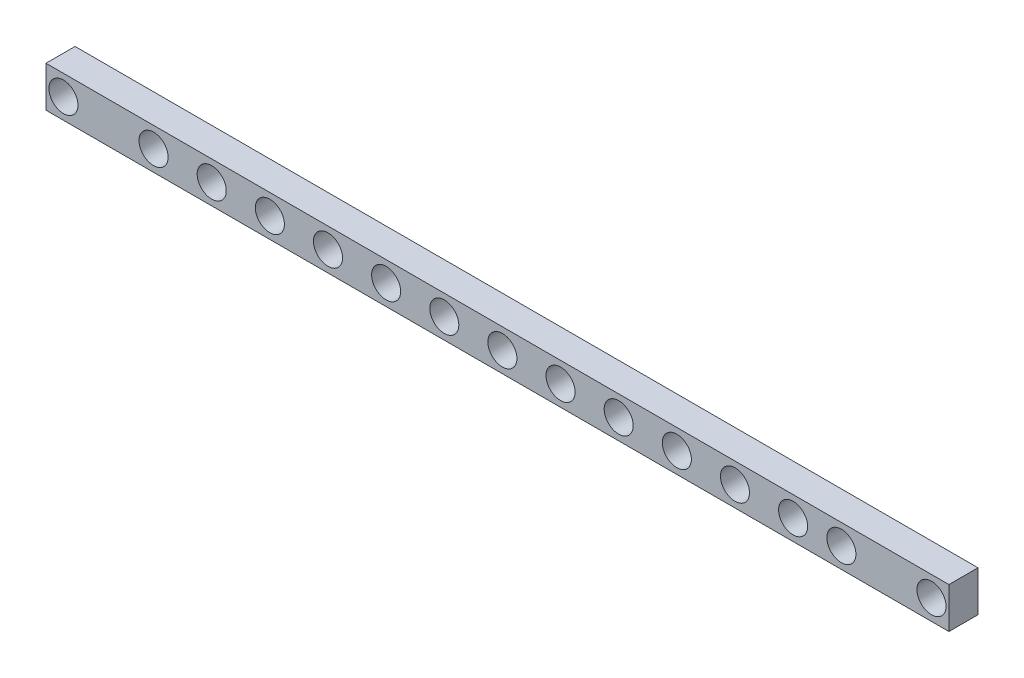
from build123d import *

# Parameters (mm, degrees)
SKETCH1_W           = 15.53
SKETCH1_H           = 0.7
SKETCH1_R           = 0.25
BOSS_EXTRUDE1_DEPTH = 0.5


with BuildPart() as part:
    # Sketch1 → Boss-Extrude1 (new body)
    with BuildSketch(Plane.XY):
        Rectangle(SKETCH1_W, SKETCH1_H)
        with Locations((-7.465, 0)):
            Circle(SKETCH1_R, mode=Mode.SUBTRACT)
        with Locations((-5.915, 0)):
            Circle(SKETCH1_R, mode=Mode.SUBTRACT)
        with Locations(Location((5.915, 0, 0), (0, 0, 180))):
            Circle(SKETCH1_R, mode=Mode.SUBTRACT)
        with Locations(Location((7.465, 0, 0), (0, 0, 180))):
            Circle(SKETCH1_R, mode=Mode.SUBTRACT)
        with Locations((-4.915, 0)):
            Circle(SKETCH1_R, mode=Mode.SUBTRACT)
        with Locations((-3.915, 0)):
            Circle(SKETCH1_R, mode=Mode.SUBTRACT)
        with Locations((-2.915, 0)):
            Circle(SKETCH1_R, mode=Mode.SUBTRACT)
        with Locations((-1.915, 0)):
            Circle(SKETCH1_R, mode=Mode.SUBTRACT)
        with Locations((-0.915, 0)):
            Circle(SKETCH1_R, mode=Mode.SUBTRACT)
        with Locations((0.085, 0)):
            Circle(SKETCH1_R, mode=Mode.SUBTRACT)
        with Locations((1.085, 0)):
            Circle(SKETCH1_R, mode=Mode.SUBTRACT)
        with Locations((2.085, 0)):
            Circle(SKETCH1_R, mode=Mode.SUBTRACT)
        with Locations((3.085, 0)):
            Circle(SKETCH1_R, mode=Mode.SUBTRACT)
        with Locations((4.085, 0)):
            Circle(SKETCH1_R, mode=Mode.SUBTRACT)
        with Locations((5.085, 0)):
            Circle(SKETCH1_R, mode=Mode.SUBTRACT)
    extrude(amount=BOSS_EXTRUDE1_DEPTH)


solid = part.part
